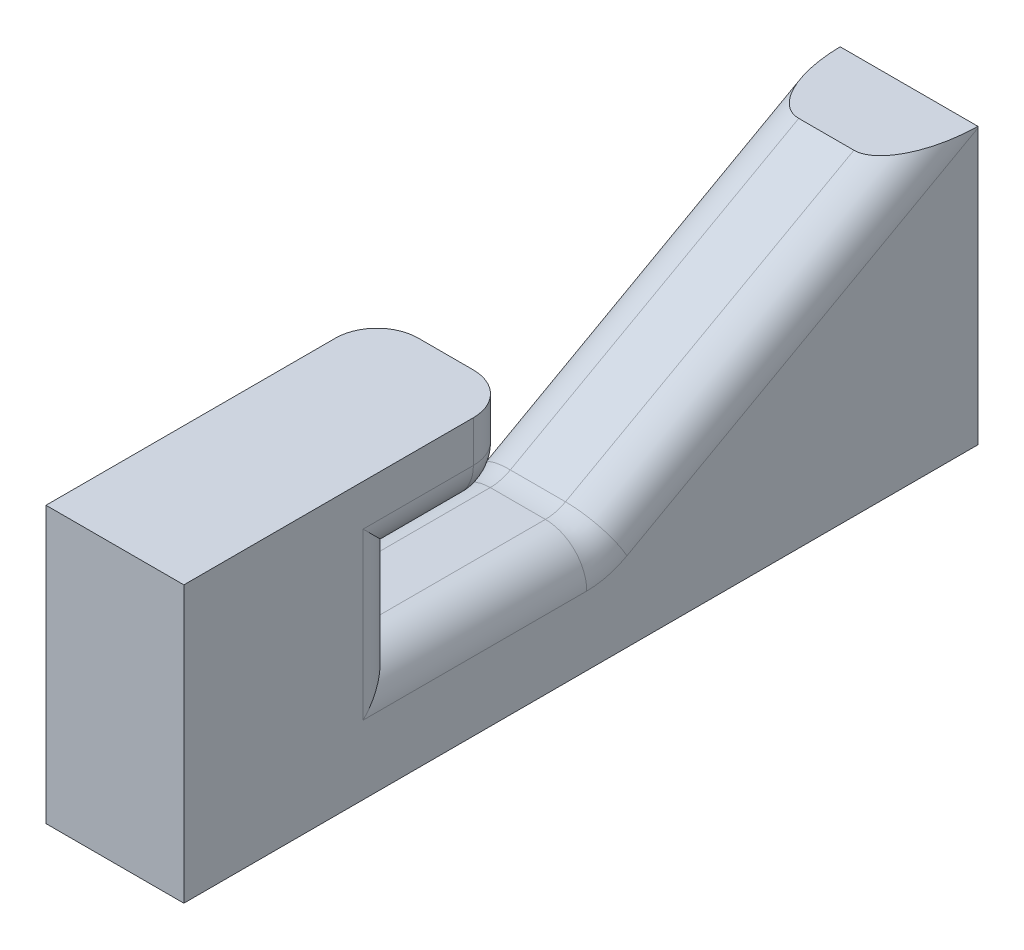
from build123d import *

# Parameters (mm, degrees)
SKETCH2_W           = 10
SKETCH2_H           = 28.8
BOSS_EXTRUDE1_DEPTH = 5
SKETCH3_W           = 3
SKETCH3_H           = 4
CUT_EXTRUDE1_DEPTH  = 31.894012365
FILLET2_R           = 1.5


with BuildPart() as part:
    # Sketch2 → Boss-Extrude1 (new body)
    with BuildSketch(Plane.YZ):
        with Locations((5, 14.4)):
            Rectangle(SKETCH2_W, SKETCH2_H)
    extrude(amount=BOSS_EXTRUDE1_DEPTH)

    # Sketch3 → Cut-Extrude1 (cut, through all)
    with BuildSketch(Plane.YZ.offset(5)):
        with Locations((5.5, 18.8)):
            Rectangle(SKETCH3_W, SKETCH3_H)
        Polygon((7, 16.8), (4, 16.8), (4, 13.8), (10, 3), (10, 16.8), align=None)
    extrude(amount=-CUT_EXTRUDE1_DEPTH, mode=Mode.SUBTRACT)

    # Fillet2
    fillet2_edges = [part.edges().sort_by_distance(p)[0] for p in [
        (5, 4, 17.3),
        (2.5, 4, 13.8),
        (0, 5.5, 20.8),
        (5, 7, 18.8),
        (0, 8.5, 16.8),
        (2.5, 7, 16.8),
        (0, 7, 8.4),
        (0, 4, 17.3),
        (0, 7, 18.8),
        (5, 7, 8.4),
        (5, 8.5, 16.8),
        (5, 5.5, 20.8),
    ]]
    fillet(fillet2_edges, radius=FILLET2_R)


solid = part.part
